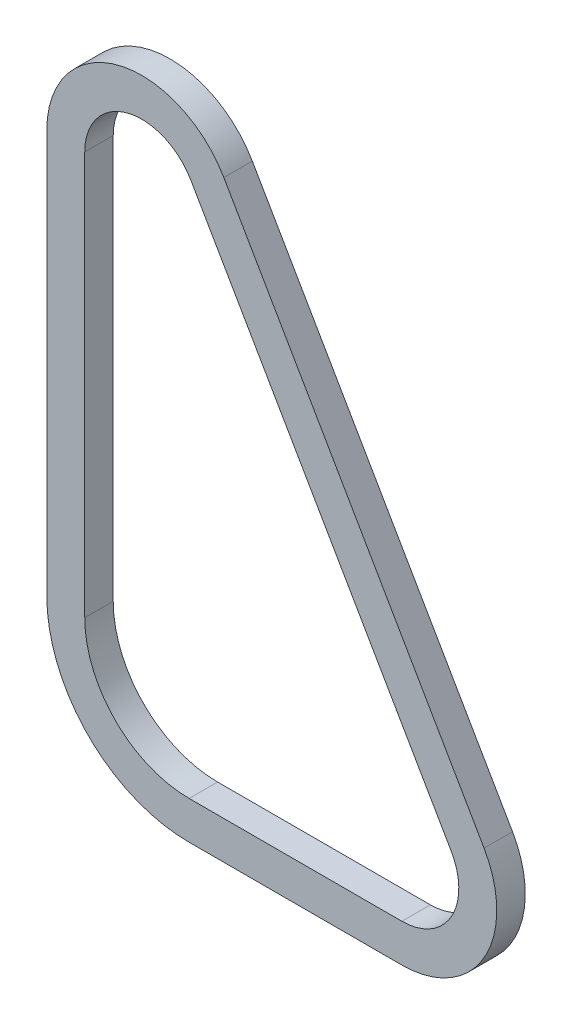
from build123d import *

# Parameters (mm, degrees)
BOSS_EXTRUDE3_DEPTH = 30


with BuildPart() as part:
    # Sketch1 → Boss-Extrude3 (new body)
    with BuildSketch(Plane.XY):
        with BuildLine():
            Line((136.602540378, 50), (410.843918244, -425))
            ThreePointArc((410.843918244, -425), (410.843918244, -525), (324.241377865, -575))
            Line((324.241377865, -575), (100, -575))
            ThreePointArc((100, -575), (-6.066017178, -531.066017178), (-50, -425))
            Line((-50, -425), (-50, 0))
            ThreePointArc((-50, 0), (24.11809549, 96.592582629), (136.602540378, 50))
        make_face()
        with BuildLine():
            Line((101.961524227, 30), (376.202902092, -445))
            ThreePointArc((376.202902092, -445), (376.202902092, -505), (324.241377865, -535))
            Line((324.241377865, -535), (100, -535))
            ThreePointArc((100, -535), (22.218254069, -502.781745931), (-10, -425))
            Line((-10, -425), (-10, 0))
            ThreePointArc((-10, 0), (34.470857294, 57.955549577), (101.961524227, 30))
        make_face(mode=Mode.SUBTRACT)
    extrude(amount=BOSS_EXTRUDE3_DEPTH)


solid = part.part
